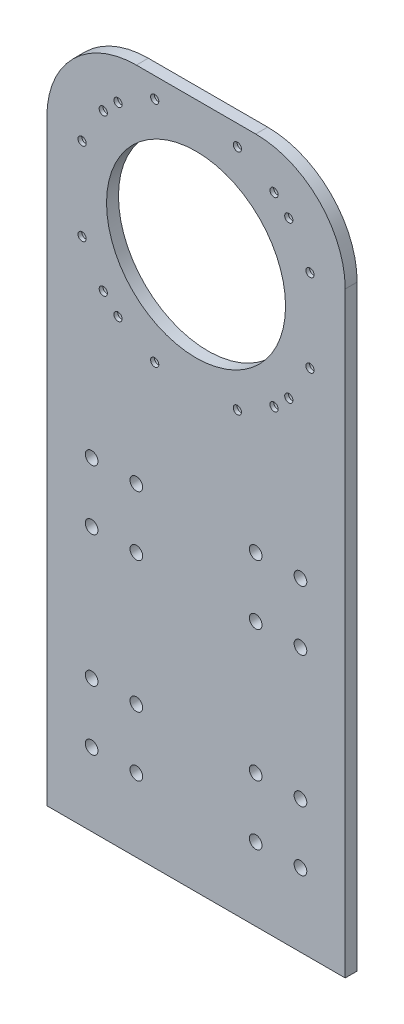
from build123d import *

# Parameters (mm, degrees)
SKETCH_1_W          = 200
SKETCH_1_H          = 460
EXTRUDE_1_DEPTH     = 8
SKETCH_2_R          = 60
CUT_EXTRUDE_1_DEPTH = 10
FILLET_1_R          = 60
SKETCH_3_R          = 2.75
CUT_EXTRUDE_2_DEPTH = 10
SKETCH_4_R          = 6
CUT_EXTRUDE_3_DEPTH = 5.5
SKETCH_5_R          = 4.25
CUT_EXTRUDE_4_DEPTH = 10


with BuildPart() as part:
    # 草图1 → 凸台-拉伸1 (new body)
    with BuildSketch(Plane.XY):
        with Locations((0, 230)):
            Rectangle(SKETCH_1_W, SKETCH_1_H)
    extrude(amount=EXTRUDE_1_DEPTH)

    # 草图2 → 切除-拉伸1 (cut)
    with BuildSketch(Plane(origin=(0, 0, 0), x_dir=(-1, 0, 0), z_dir=(0, 0, -1))):
        with Locations((0, 370)):
            Circle(SKETCH_2_R)
    extrude(amount=-CUT_EXTRUDE_1_DEPTH, mode=Mode.SUBTRACT)

    # 圆角1
    fillet_1_edges = [part.edges().sort_by_distance(p)[0] for p in [
        (100, 460, 4),
        (-100, 460, 4),
    ]]
    fillet(fillet_1_edges, radius=FILLET_1_R)

    # 草图3 → 切除-拉伸2 (cut)
    with BuildSketch(Plane.XY.offset(8)):
        with Locations((27.706208015, 446.380158009)):
            Circle(SKETCH_3_R)
        with Locations((52.294053173, 432.184358988)):
            Circle(SKETCH_3_R)
        with Locations((62.184358988, 422.294053173)):
            Circle(SKETCH_3_R)
        with Locations((76.380158009, 397.706208015)):
            Circle(SKETCH_3_R)
        with Locations((76.380158009, 342.293791985)):
            Circle(SKETCH_3_R)
        with Locations((62.184358988, 317.705946827)):
            Circle(SKETCH_3_R)
        with Locations((52.294053173, 307.815641012)):
            Circle(SKETCH_3_R)
        with Locations((27.706208015, 293.619841991)):
            Circle(SKETCH_3_R)
        with Locations((-27.706208015, 293.619841991)):
            Circle(SKETCH_3_R)
        with Locations((-52.294053173, 307.815641012)):
            Circle(SKETCH_3_R)
        with Locations((-62.184358988, 317.705946827)):
            Circle(SKETCH_3_R)
        with Locations((-76.380158009, 342.293791985)):
            Circle(SKETCH_3_R)
        with Locations((-76.380158009, 397.706208015)):
            Circle(SKETCH_3_R)
        with Locations((-62.184358988, 422.294053173)):
            Circle(SKETCH_3_R)
        with Locations((-52.294053173, 432.184358988)):
            Circle(SKETCH_3_R)
        with Locations((-27.706208015, 446.380158009)):
            Circle(SKETCH_3_R)
    extrude(amount=-CUT_EXTRUDE_2_DEPTH, mode=Mode.SUBTRACT)

    # 草图4 → 切除-拉伸3 (cut)
    with BuildSketch(Plane(origin=(0, 0, 0), x_dir=(-1, 0, 0), z_dir=(0, 0, -1))):
        with Locations((27.706208015, 446.380158009)):
            Circle(SKETCH_4_R)
        with Locations((52.294053173, 432.184358988)):
            Circle(SKETCH_4_R)
        with Locations((62.184358988, 422.294053173)):
            Circle(SKETCH_4_R)
        with Locations((76.380158009, 397.706208015)):
            Circle(SKETCH_4_R)
        with Locations((76.380158009, 342.293791985)):
            Circle(SKETCH_4_R)
        with Locations((62.184358988, 317.705946827)):
            Circle(SKETCH_4_R)
        with Locations((52.294053173, 307.815641012)):
            Circle(SKETCH_4_R)
        with Locations((27.706208015, 293.619841991)):
            Circle(SKETCH_4_R)
        with Locations((-27.706208015, 293.619841991)):
            Circle(SKETCH_4_R)
        with Locations((-52.294053173, 307.815641012)):
            Circle(SKETCH_4_R)
        with Locations((-62.184358988, 317.705946827)):
            Circle(SKETCH_4_R)
        with Locations((-76.380158009, 342.293791985)):
            Circle(SKETCH_4_R)
        with Locations((-76.380158009, 397.706208015)):
            Circle(SKETCH_4_R)
        with Locations((-62.184358988, 422.294053173)):
            Circle(SKETCH_4_R)
        with Locations((-52.294053173, 432.184358988)):
            Circle(SKETCH_4_R)
        with Locations((-27.706208015, 446.380158009)):
            Circle(SKETCH_4_R)
    extrude(amount=-CUT_EXTRUDE_3_DEPTH, mode=Mode.SUBTRACT)

    # 草图5 → 切除-拉伸4 (cut)
    with BuildSketch(Plane(origin=(0, 0, 0), x_dir=(-1, 0, 0), z_dir=(0, 0, -1))):
        with Locations((40, 49)):
            Circle(SKETCH_5_R)
        with Locations((70, 49)):
            Circle(SKETCH_5_R)
        with Locations((40, 89)):
            Circle(SKETCH_5_R)
        with Locations((70, 89)):
            Circle(SKETCH_5_R)
        with Locations((40, 217)):
            Circle(SKETCH_5_R)
        with Locations((70, 177)):
            Circle(SKETCH_5_R)
        with Locations((40, 177)):
            Circle(SKETCH_5_R)
        with Locations((70, 217)):
            Circle(SKETCH_5_R)
        with Locations(Location((-70, 217, 0), (0, 0, 180))):
            Circle(SKETCH_5_R)
        with Locations(Location((-40, 177, 0), (0, 0, 180))):
            Circle(SKETCH_5_R)
        with Locations(Location((-70, 177, 0), (0, 0, 180))):
            Circle(SKETCH_5_R)
        with Locations(Location((-40, 217, 0), (0, 0, 180))):
            Circle(SKETCH_5_R)
        with Locations(Location((-70, 89, 0), (0, 0, 180))):
            Circle(SKETCH_5_R)
        with Locations(Location((-40, 89, 0), (0, 0, 180))):
            Circle(SKETCH_5_R)
        with Locations(Location((-70, 49, 0), (0, 0, 180))):
            Circle(SKETCH_5_R)
        with Locations(Location((-40, 49, 0), (0, 0, 180))):
            Circle(SKETCH_5_R)
    extrude(amount=-CUT_EXTRUDE_4_DEPTH, mode=Mode.SUBTRACT)


solid = part.part
